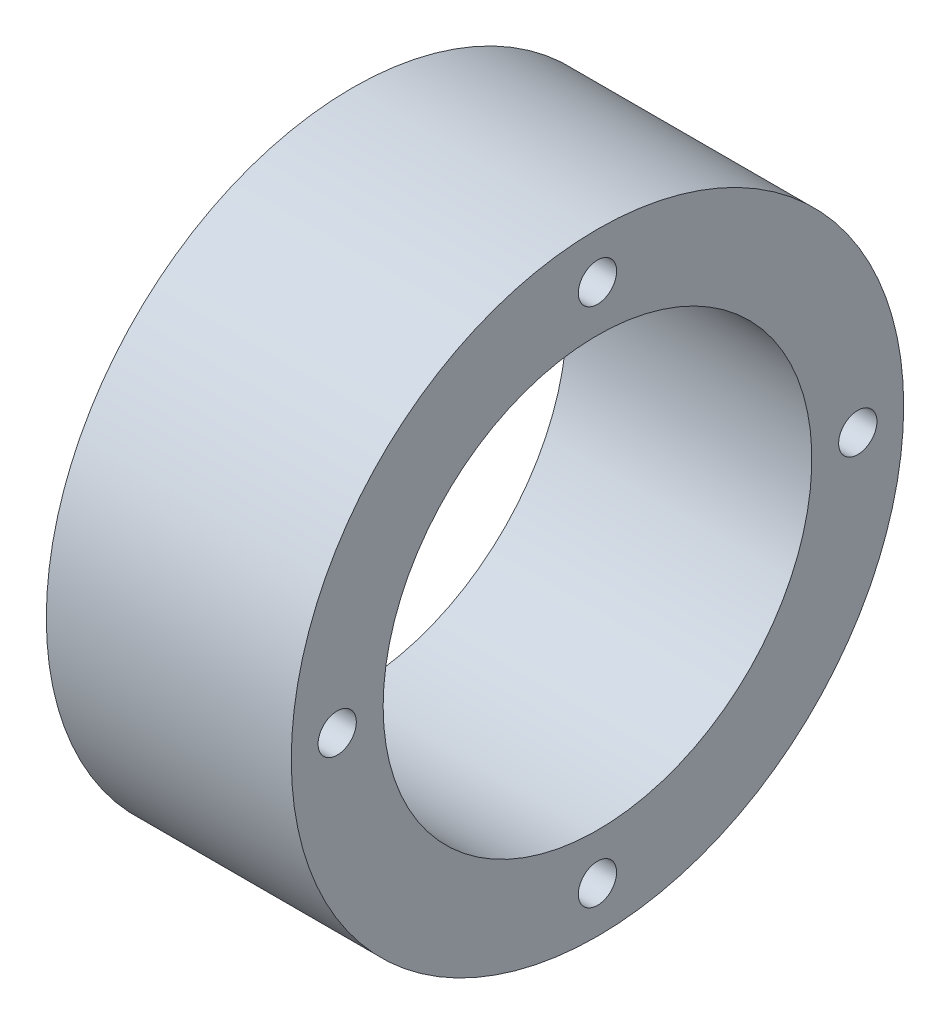
from build123d import *

# Parameters (mm, degrees)
M3_GEWINDEBOHRUNG1_D = 2.5
KREISMUSTER2_COUNT   = 4


with BuildPart() as part:
    # Skizze1 → Rotation1 (revolve)
    with BuildSketch(Plane.XY):
        Polygon((-31.181837907, 20), (-31.181837907, 14), (-29.181837907, 14), (-15.181837907, 14), (-15.181837907, 20), align=None)
    revolve(axis=Axis((-37.668433178, 0, 0), (1, 0, 0)))

    # M3 Gewindebohrung1 (through all)
    with Locations(Plane(origin=(-15.181837907, 0, 0), x_dir=(0, 0, -1), z_dir=(1, 0, 0))):
        with Locations((0, 17)):
            m3_gewindebohrung1 = Hole(M3_GEWINDEBOHRUNG1_D / 2)

    # Kreismuster2: M3 Gewindebohrung1 ×4 about axis
    kreismuster2_axis = Axis((-15.181837907, 0, 0), (-1, 0, 0))
    for i in range(1, KREISMUSTER2_COUNT):
        add(m3_gewindebohrung1.rotate(kreismuster2_axis, i * 360 / KREISMUSTER2_COUNT), mode=Mode.SUBTRACT)


solid = part.part
